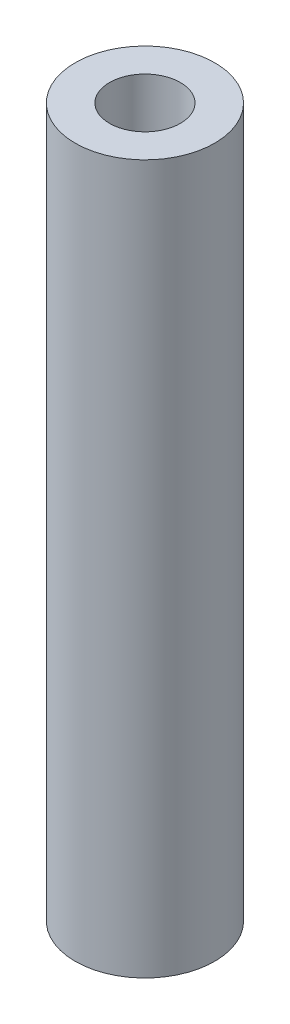
from build123d import *

# Parameters (mm, degrees)
SKETCH_1_R      = 5
SKETCH_1_R_2    = 2.54
EXTRUDE_1_DEPTH = 50.8


with BuildPart() as part:
    # 草图1 → 凸台-拉伸1 (new body)
    with BuildSketch(Plane(origin=(0, 0, 0), x_dir=(1, 0, 0), z_dir=(0, 1, 0))):
        with Locations(Location((0, 0, 0), (0, 0, 270))):
            Circle(SKETCH_1_R)
        with Locations(Location((0, 0, 0), (0, 0, 270))):
            Circle(SKETCH_1_R_2, mode=Mode.SUBTRACT)
    extrude(amount=EXTRUDE_1_DEPTH)


solid = part.part
